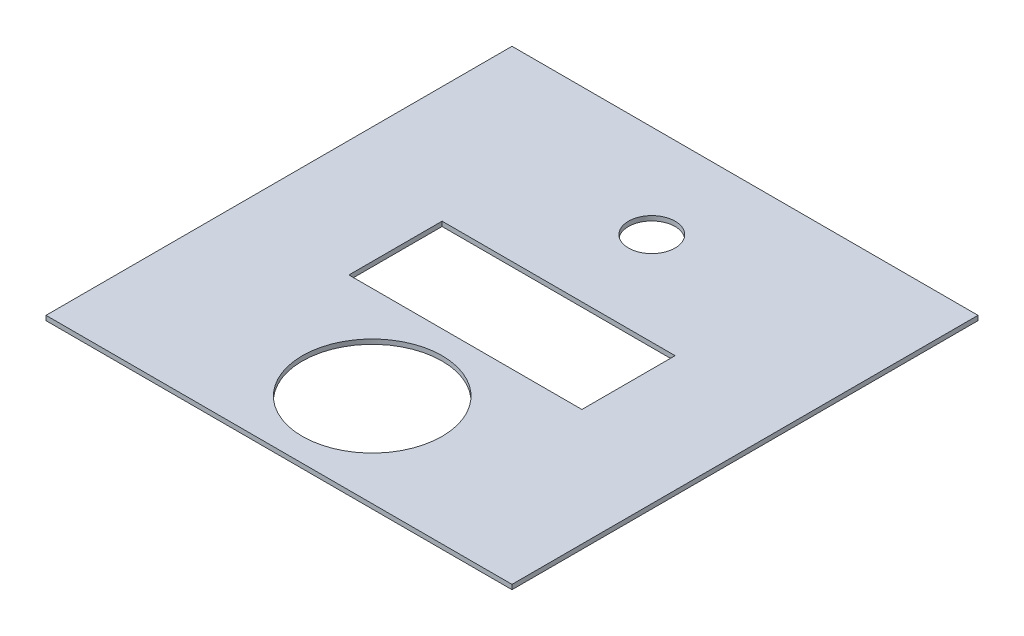
from build123d import *

# Parameters (mm, degrees)
SKETCH1_W           = 100
SKETCH1_H           = 100
BOSS_EXTRUDE1_DEPTH = 1
SKETCH2_W           = 50
SKETCH2_H           = 20
CUT_EXTRUDE1_DEPTH  = 1
SKETCH3_R           = 5
SKETCH3_R_2         = 15
CUT_EXTRUDE2_DEPTH  = 1


with BuildPart() as part:
    # Sketch1 → Boss-Extrude1 (new body)
    with BuildSketch(Plane(origin=(0, 0, 0), x_dir=(1, 0, 0), z_dir=(0, 1, 0))):
        Rectangle(SKETCH1_W, SKETCH1_H)
    extrude(amount=BOSS_EXTRUDE1_DEPTH)

    # Sketch2 → Cut-Extrude1 (cut)
    with BuildSketch(Plane(origin=(0, 1, 0), x_dir=(1, 0, 0), z_dir=(0, 1, 0))):
        Rectangle(SKETCH2_W, SKETCH2_H)
    extrude(amount=-CUT_EXTRUDE1_DEPTH, mode=Mode.SUBTRACT)

    # Sketch3 → Cut-Extrude2 (cut)
    with BuildSketch(Plane(origin=(0, 1, 0), x_dir=(1, 0, 0), z_dir=(0, 1, 0))):
        with Locations(Location((0, 30, 0), (0, 0, 270))):
            Circle(SKETCH3_R)
        with Locations(Location((0, -30, 0), (0, 0, 270))):
            Circle(SKETCH3_R_2)
    extrude(amount=-CUT_EXTRUDE2_DEPTH, mode=Mode.SUBTRACT)


solid = part.part
